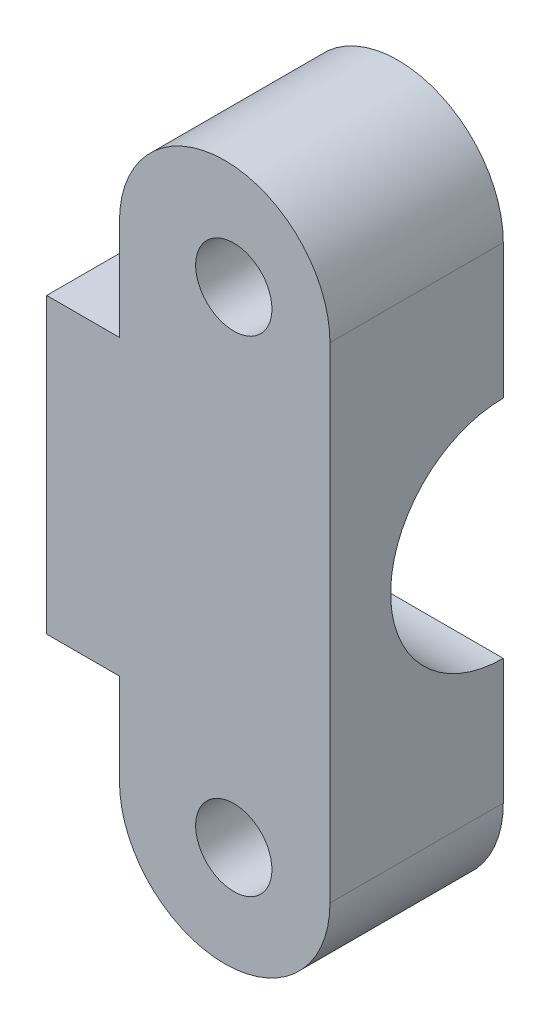
from build123d import *

# Parameters (mm, degrees)
ESQUISSE1_R             = 1.1
EXTRUSION1_DEPTH        = 5
ESQUISSE2_R             = 3.25
ENL_V_MAT_EXTRU_1_DEPTH = 59.283442679


with BuildPart() as part:
    # Esquisse1 → Extrusion1 (new body)
    with BuildSketch(Plane.XY):
        with BuildLine():
            Line((-15.792310365, 40.455003044), (-15.792310365, 54.455003044))
            ThreePointArc((-15.792310365, 54.455003044), (-18.828177284, 57.490869963), (-21.864044203, 54.455003044))
            Line((-21.864044203, 54.455003044), (-21.864044203, 51.547447727))
            Line((-21.864044203, 51.547447727), (-23.962962816, 51.547447727))
            Line((-23.962962816, 51.547447727), (-23.962962816, 43.086270123))
            Line((-23.962962816, 43.086270123), (-21.864044203, 43.086270123))
            Line((-21.864044203, 43.086270123), (-21.864044203, 40.455003044))
            ThreePointArc((-21.864044203, 40.455003044), (-18.828177284, 37.419136124), (-15.792310365, 40.455003044))
        make_face()
        with Locations((-18.566221644, 40.455003043)):
            Circle(ESQUISSE1_R, mode=Mode.SUBTRACT)
        with Locations((-18.566221644, 54.455003043)):
            Circle(ESQUISSE1_R, mode=Mode.SUBTRACT)
    extrude(amount=EXTRUSION1_DEPTH)

    # Esquisse2 → Enlèv. mat.-Extru.1 (cut, through all)
    with BuildSketch(Plane.ZY.offset(23.962962816)):
        with Locations((0, 47.316858925)):
            Circle(ESQUISSE2_R)
    extrude(amount=-ENL_V_MAT_EXTRU_1_DEPTH, mode=Mode.SUBTRACT)


solid = part.part
